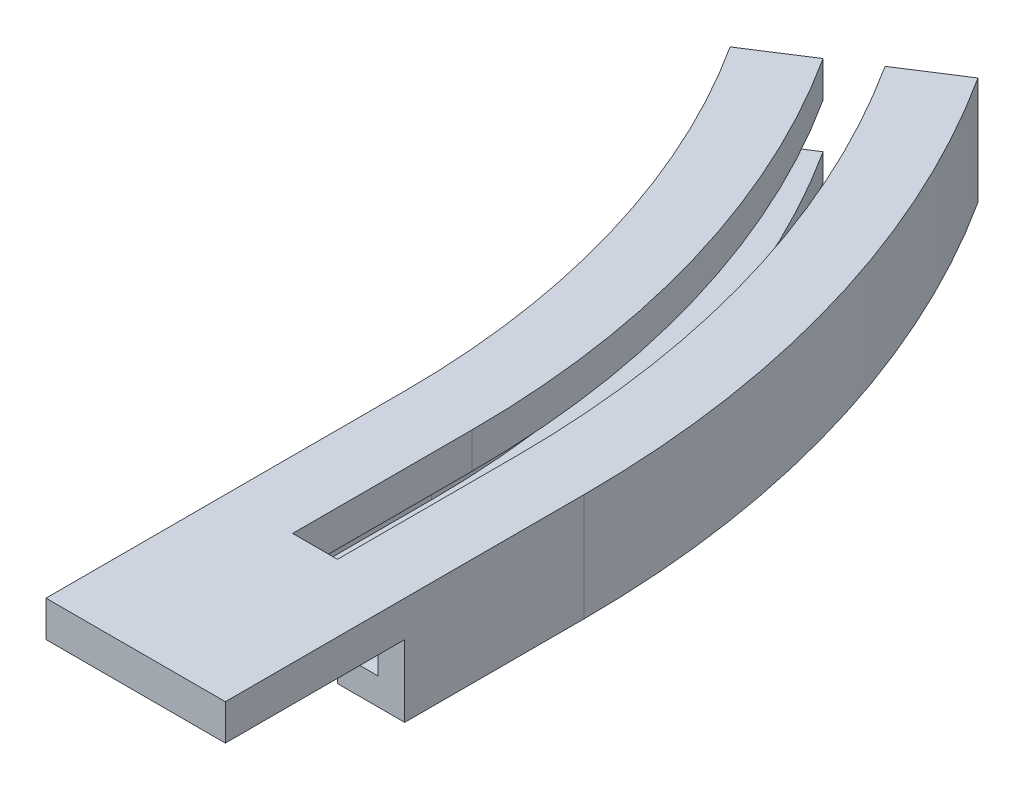
from build123d import *

# Parameters (mm, degrees)
BOSS_EXTRUDE1_DEPTH = 4
BOSS_EXTRUDE2_START = 5
BOSS_EXTRUDE2_DEPTH = 5
BOSS_EXTRUDE3_START = 3
BOSS_EXTRUDE3_DEPTH = 3
CUT_EXTRUDE1_START  = -43
CUT_EXTRUDE1_DEPTH  = 43


with BuildPart() as part:
    # Sketch1 → Boss-Extrude1 (new body)
    with BuildSketch(Plane(origin=(0, 0, 0), x_dir=(1, 0, 0), z_dir=(0, 1, 0))):
        with BuildLine():
            Line((86.216175346, 55.434836598), (79.907674711, 51.378629042))
            ThreePointArc((79.907674711, 51.378629042), (91.148859284, 26.774716641), (95, 0))
            Line((95, 0), (102.5, 0))
            ThreePointArc((102.5, 0), (98.344821859, 28.88851006), (86.216175346, 55.434836598))
        make_face()
        with BuildLine():
            Line((96.730343071, 62.195182525), (90.421842436, 58.138974969))
            ThreePointArc((90.421842436, 58.138974969), (103.142130242, 30.297705673), (107.5, 0))
            Line((107.5, 0), (115, 0))
            ThreePointArc((115, 0), (110.338092817, 32.411499092), (96.730343071, 62.195182525))
        make_face()
        Polygon((102.5, 0), (95, 0), (95, -40), (115, -40), (115, 0), (107.5, 0), (107.5, -20), (102.5, -20), align=None)
    extrude(amount=BOSS_EXTRUDE1_DEPTH)

    # Sketch2 → Boss-Extrude2 (add)
    with BuildSketch(Plane.XZ.offset(BOSS_EXTRUDE2_START)):
        with BuildLine():
            Line((112, 20), (112, 0))
            ThreePointArc((112, 0), (107.459707787, -31.565981725), (94.206942817, -60.572699503))
            Line((94.206942817, -60.572699503), (96.730343071, -62.195182525))
            ThreePointArc((96.730343071, -62.195182525), (110.338092817, -32.411499092), (115, 0))
            Line((115, 0), (115, 20))
            Line((115, 20), (112, 20))
        make_face()
        with BuildLine():
            ThreePointArc((82.431074965, -53.001112065), (94.027244314, -27.620234009), (98, 0))
            Line((98, 0), (98, 20))
            Line((98, 20), (95, 20))
            Line((95, 20), (95, 0))
            ThreePointArc((95, 0), (91.148859284, -26.774716641), (79.907674711, -51.378629042))
            Line((79.907674711, -51.378629042), (82.431074965, -53.001112065))
        make_face()
    extrude(amount=-BOSS_EXTRUDE2_DEPTH)

    # Sketch3 → Boss-Extrude3 (add)
    with BuildSketch(Plane.XZ.offset(5).offset(BOSS_EXTRUDE3_START)):
        with BuildLine():
            Line((98, 20), (112, 20))
            Line((112, 20), (115, 20))
            Line((115, 20), (115, 0))
            ThreePointArc((115, 0), (110.338092817, -32.411499092), (96.730343071, -62.195182525))
            Line((96.730343071, -62.195182525), (94.206942817, -60.572699503))
            Line((94.206942817, -60.572699503), (82.431074965, -53.001112065))
            Line((82.431074965, -53.001112065), (79.907674711, -51.378629042))
            ThreePointArc((79.907674711, -51.378629042), (91.148859284, -26.774716641), (95, 0))
            Line((95, 0), (95, 20))
            Line((95, 20), (98, 20))
        make_face()
    extrude(amount=-BOSS_EXTRUDE3_DEPTH)

    # Sketch4 → Cut-Extrude1 (cut)
    with BuildSketch(Plane(origin=(0, 4, 0), x_dir=(1, 0, 0), z_dir=(0, 1, 0)).offset(CUT_EXTRUDE1_START)):
        with BuildLine():
            Line((90.421842436, 58.138974969), (86.216175346, 55.434836598))
            ThreePointArc((86.216175346, 55.434836598), (98.344821859, 28.88851006), (102.5, 0))
            Line((102.5, 0), (102.5, -20))
            Line((102.5, -20), (107.5, -20))
            Line((107.5, -20), (107.5, 0))
            ThreePointArc((107.5, 0), (103.142130242, 30.297705673), (90.421842436, 58.138974969))
        make_face()
    extrude(amount=CUT_EXTRUDE1_DEPTH, mode=Mode.SUBTRACT)


solid = part.part
